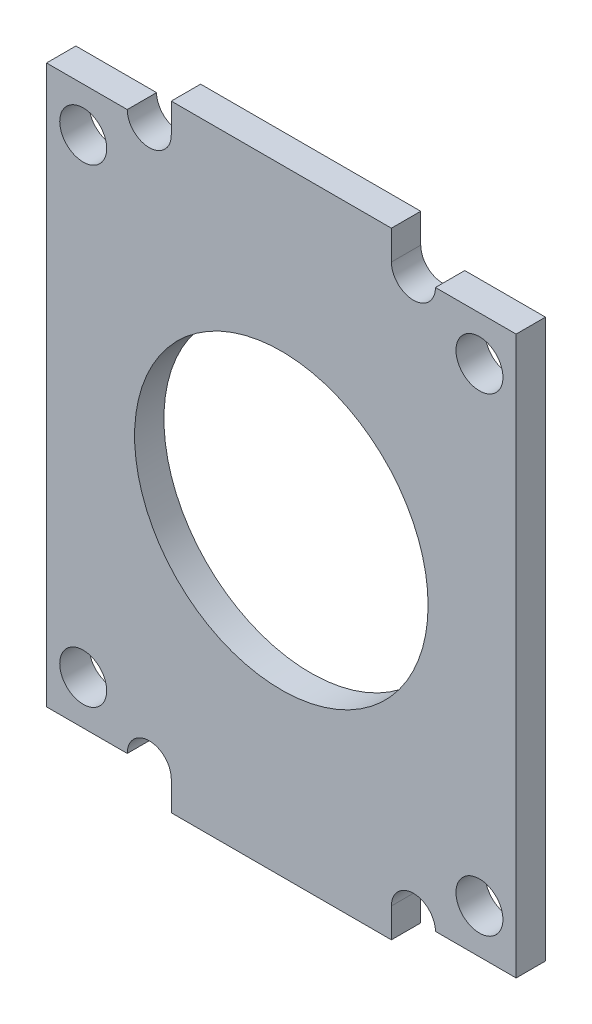
from build123d import *

# Parameters (mm, degrees)
SKETCH_1_W          = 32
SKETCH_1_H          = 38
EXTRUDE_1_DEPTH     = 2
SKETCH_2_R          = 10
CUT_EXTRUDE_1_DEPTH = 3
SKETCH_3_W          = 15
SKETCH_3_H          = 2
EXTRUDE_2_DEPTH     = 2
SKETCH_4_R          = 1.5
CUT_EXTRUDE_2_DEPTH = 3
SKETCH_5_R          = 1.6
CUT_EXTRUDE_3_DEPTH = 27.47640459


with BuildPart() as part:
    # 草图1 → 凸台-拉伸1 (new body)
    with BuildSketch(Plane.XY):
        Rectangle(SKETCH_1_W, SKETCH_1_H)
    extrude(amount=EXTRUDE_1_DEPTH)

    # 草图2 → 切除-拉伸1 (cut)
    with BuildSketch(Plane.XY.offset(2)):
        Circle(SKETCH_2_R)
    extrude(amount=-CUT_EXTRUDE_1_DEPTH, mode=Mode.SUBTRACT)

    # 草图3 → 凸台-拉伸2 (add)
    with BuildSketch(Plane.XY.offset(2)):
        with Locations((0, 20)):
            Rectangle(SKETCH_3_W, SKETCH_3_H)
        with Locations((0, -20)):
            Rectangle(SKETCH_3_W, SKETCH_3_H)
    extrude(amount=-EXTRUDE_2_DEPTH)

    # 草图4 → 切除-拉伸2 (cut)
    with BuildSketch(Plane.XY.offset(2)):
        with Locations((-9, 19)):
            Circle(SKETCH_4_R)
        with Locations((-9, -19)):
            Circle(SKETCH_4_R)
        with Locations((9, 19)):
            Circle(SKETCH_4_R)
        with Locations((9, -19)):
            Circle(SKETCH_4_R)
    extrude(amount=-CUT_EXTRUDE_2_DEPTH, mode=Mode.SUBTRACT)

    # 草图5 → 切除-拉伸3 (cut, through all)
    with BuildSketch(Plane.XY.offset(2)):
        with Locations((13.5, 16)):
            Circle(SKETCH_5_R)
        with Locations((13.5, -16)):
            Circle(SKETCH_5_R)
        with Locations(Location((-13.5, -16, 0), (0, 0, 180))):
            Circle(SKETCH_5_R)
        with Locations(Location((-13.5, 16, 0), (0, 0, 180))):
            Circle(SKETCH_5_R)
    extrude(amount=-CUT_EXTRUDE_3_DEPTH, mode=Mode.SUBTRACT)


solid = part.part
